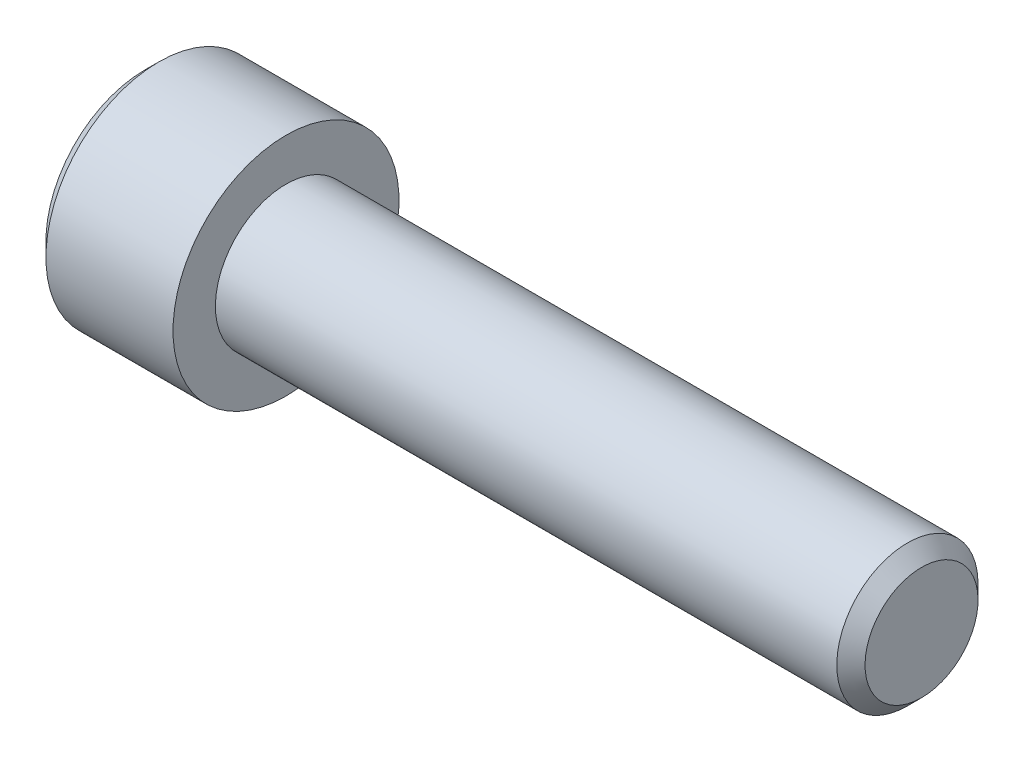
from build123d import *

# Parameters (mm, degrees)
CUT_EXTRUDE1_DEPTH = 5
CHAMFER1_SIZE      = 1


with BuildPart() as part:
    # Sketch1 → Revolve1 (revolve)
    with BuildSketch(Plane.XY, mode=Mode.PRIVATE) as revolve1_sk:
        Polygon((-10, 0), (-10, 8), (0, 8), (0, 5), (45, 5), (45, 0), align=None)
    revolve(revolve1_sk.sketch.rotate(Axis((45, 0, 0), (-1, 0, 0)), 180), axis=Axis((45, 0, 0), (-1, 0, 0)))

    # Sketch2 → Cut-Revolve1 (revolve, cut)
    with BuildSketch(Plane.XY, mode=Mode.PRIVATE) as cut_revolve1_sk:
        Polygon((-10, 0), (-10, 3.995), (-5, 3.995), (-3.929542976, 0), align=None)
    revolve(cut_revolve1_sk.sketch.rotate(Axis((-3.929542976, 0, 0), (-1, 0, 0)), 180), axis=Axis((-3.929542976, 0, 0), (-1, 0, 0)), mode=Mode.SUBTRACT)

    # Sketch3 → Cut-Extrude1 (cut)
    with BuildSketch(Plane(origin=(-10, 0, 0), x_dir=(0, 0, -1), z_dir=(1, 0, 0))):
        Polygon((0, 4.618802154), (-4, 2.309401077), (-4, -2.309401077), (0, -4.618802154), (4, -2.309401077), (4, 2.309401077), align=None)
    extrude(amount=CUT_EXTRUDE1_DEPTH, mode=Mode.SUBTRACT)

    # Chamfer1
    chamfer1_edges = [part.edges().sort_by_distance(p)[0] for p in [
        (45, 5, 0),
        (-10, 8, 0),
    ]]
    chamfer(chamfer1_edges, length=CHAMFER1_SIZE)


solid = part.part
